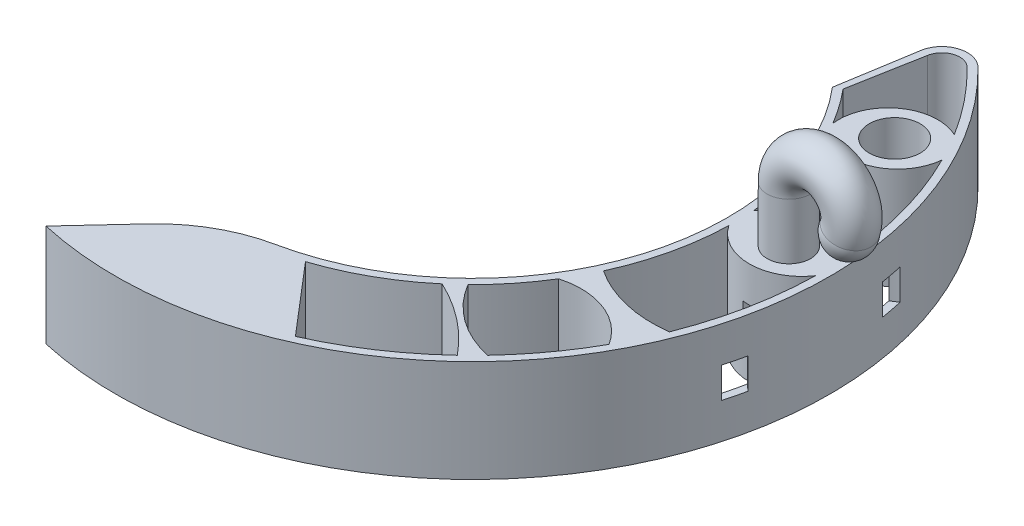
from build123d import *

# Parameters (mm, degrees)
BOSS_EXTRUDE1_DEPTH = 13.33
FILLET1_R           = 20
SKETCH3_R           = 3.33
CUT_EXTRUDE2_DEPTH  = 68.320131462
FILLET2_R           = 3.333
SKETCH4_R           = 2.8333333
DOME1_FACE_RADIUS   = 2.8333333
DOME1_HEIGHT        = 3.3333333
CUT_EXTRUDE3_DEPTH  = 2
CUT_EXTRUDE5_DEPTH  = 13.34
SKETCH19_R          = 1.425
CUT_EXTRUDE6_DEPTH  = 8.6


with BuildPart() as part:
    # Sketch1 → Boss-Extrude1 (new body)
    with BuildSketch(Plane(origin=(0, 0, 0), x_dir=(1, 0, 0), z_dir=(0, 1, 0))):
        with BuildLine():
            Line((25.438564969, 21.535280641), (27.993333135, 37.33))
            ThreePointArc((27.993333135, 37.33), (42.371570445, -19.53984693), (-10.216878485, -45.527694802))
            Line((-10.216878485, -45.527694802), (1.110949751, -33.311479863))
            ThreePointArc((1.110949751, -33.311479863), (30.46737546, -13.513990254), (25.438564969, 21.535280641))
        make_face()
    extrude(amount=BOSS_EXTRUDE1_DEPTH)

    # Fillet1
    fillet1_edges = [part.edges().sort_by_distance(p)[0] for p in [
        (1.110949751, 6.665, 33.311479863),
    ]]
    fillet(fillet1_edges, radius=FILLET1_R)

    # Sketch3 → Cut-Extrude2 (cut, through all)
    with BuildSketch(Plane(origin=(0, 13.33, 0), x_dir=(1, 0, 0), z_dir=(0, 1, 0))):
        with Locations(Location((35.289122258, 19.812921474, 0), (0, 0, 270))):
            Circle(SKETCH3_R)
    extrude(amount=-CUT_EXTRUDE2_DEPTH, mode=Mode.SUBTRACT)

    # Fillet2
    fillet2_edges = [part.edges().sort_by_distance(p)[0] for p in [
        (27.993333135, 6.665, -37.33),
    ]]
    fillet(fillet2_edges, radius=FILLET2_R)

    # Sweep1: sweep along a path in Sketch6
    with BuildLine(Plane.XY) as sweep1_path:
        Line((40.567020893, 13.33), (40.567020893, 20.636666))
        ThreePointArc((40.567020893, 20.636666), (45.278451651, 24.683063573), (48.567020893, 19.414645837))
    # Sketch4 → Sweep1 (sweep)
    with BuildSketch(Plane(origin=(0, 13.33, 0), x_dir=(1, 0, 0), z_dir=(0, 1, 0))):
        with Locations((40.567020893, 0.715488074)):
            Circle(SKETCH4_R)
    sweep(path=sweep1_path.line)

    # Dome1: a dome of height H over a round flat face of radius A is a cap of a sphere of radius (A * A + H * H) / (2 * H)
    dome1_r = (DOME1_FACE_RADIUS * DOME1_FACE_RADIUS + DOME1_HEIGHT * DOME1_HEIGHT) / (2 * DOME1_HEIGHT)
    dome1_base = Plane((48.567020893, 19.414645837, -0.715488074), z_dir=(-0.298539128134, -0.954397395728, 0))
    with Locations(dome1_base.offset(DOME1_HEIGHT - dome1_r)):
        dome1_ball = Sphere(dome1_r, mode=Mode.PRIVATE)
    add(split(dome1_ball, bisect_by=dome1_base, keep=Keep.TOP, mode=Mode.PRIVATE))

    # Sketch7 → Cut-Extrude3 (cut, symmetric)
    with BuildSketch(Plane(origin=(0, 6.665, 0), x_dir=(1, 0, 0), z_dir=(0, 1, 0))):
        with BuildLine():
            ThreePointArc((44.965852541, -12.459041105), (45.327303444, -11.072089345), (45.645985213, -9.674690379))
            ThreePointArc((45.645985213, -9.674690379), (41.52914689, -0.997602982), (46.057874066, 7.47180276))
            ThreePointArc((46.057874066, 7.47180276), (45.806657105, 8.882891694), (45.51221871, 10.285599066))
            ThreePointArc((45.51221871, 10.285599066), (38.862616133, -0.933548234), (44.965852541, -12.459041105))
        make_face()
    extrude(amount=CUT_EXTRUDE3_DEPTH, both=True, mode=Mode.SUBTRACT)

    # Sketch18 → Cut-Extrude5 (cut)
    with BuildSketch(Plane.XZ):
        with BuildLine():
            Line((28.039143401, -31.35294351), (26.341104847, -22.015791956))
            ThreePointArc((26.341104847, -22.015791956), (28.034108775, -19.815086303), (29.543730196, -17.484762112))
            ThreePointArc((29.543730196, -17.484762112), (32.195597251, -23.521489799), (38.760601016, -24.1340301))
            ThreePointArc((38.760601016, -24.1340301), (35.637384762, -28.544919116), (32.014856699, -32.555868143))
            ThreePointArc((32.014856699, -32.555868143), (29.659442281, -33.169198731), (28.039143401, -31.35294351))
        make_face()
        with BuildLine():
            Line((18.550254331, 41.721980589), (10.749078367, 32.603776074))
            ThreePointArc((10.749078367, 32.603776074), (16.777611199, 29.950970977), (22.188585816, 26.195716434))
            ThreePointArc((22.188585816, 26.195716434), (27.124492616, 29.226219474), (31.260994101, 33.280412374))
            ThreePointArc((31.260994101, 33.280412374), (25.260742984, 38.035910189), (18.550254331, 41.721980589))
        make_face()
        with BuildLine():
            ThreePointArc((40.820629514, -20.457561098), (36.928571374, -15.146521153), (30.394540812, -15.959974588))
            ThreePointArc((30.394540812, -15.959974588), (33.016991898, -9.403570916), (34.242514373, -2.449307946))
            ThreePointArc((34.242514373, -2.449307946), (39.834796056, -4.973265496), (45.573843855, -2.803632696))
            ThreePointArc((45.573843855, -2.803632696), (44.089869065, -11.870932812), (40.820629514, -20.457561098))
        make_face()
        with BuildLine():
            ThreePointArc((45.651589838, 0.876324867), (39.98520163, 3.873028579), (34.318813422, 0.876324867))
            ThreePointArc((34.318813422, 0.876324867), (33.458600037, 7.685764997), (31.260994101, 14.187993085))
            ThreePointArc((31.260994101, 14.187993085), (36.627069292, 16.498940097), (42.462553984, 16.785919968))
            ThreePointArc((42.462553984, 16.785919968), (44.769458221, 8.973918351), (45.651589838, 0.876324867))
        make_face()
        with BuildLine():
            ThreePointArc((39.931059829, 22.143758962), (35.264351947, 18.298272838), (29.224062449, 18.013968857))
            ThreePointArc((29.224062449, 18.013968857), (26.794540492, 21.461628545), (23.960583625, 24.58534792))
            ThreePointArc((23.960583625, 24.58534792), (27.897400776, 28.917406773), (33.24466644, 31.299005627))
            ThreePointArc((33.24466644, 31.299005627), (36.873111669, 26.929709168), (39.931059829, 22.143758962))
        make_face()
    extrude(amount=-CUT_EXTRUDE5_DEPTH, mode=Mode.SUBTRACT)

    # Sketch19 → Cut-Extrude6 (cut, symmetric)
    with BuildSketch(Plane(origin=(15.613362891, 0, 27.64706404), x_dir=(0.8707413871359999, 0, -0.491741229437267), z_dir=(0.491741229437267, 0, 0.8707413871359999))):
        with Locations(Location((-14.136648815, 6.665, 0), (0, 0, 180))):
            Circle(SKETCH19_R)
    extrude(amount=CUT_EXTRUDE6_DEPTH, both=True, mode=Mode.SUBTRACT)


solid = part.part
